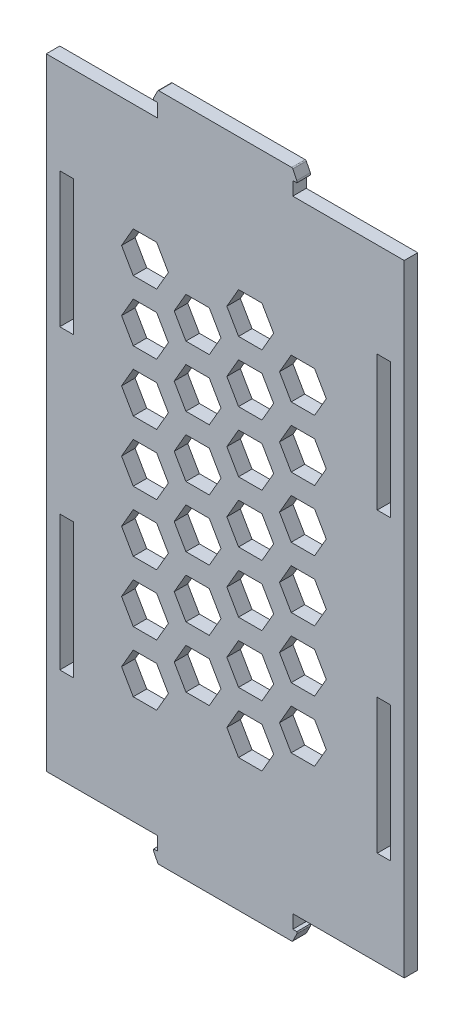
from build123d import *

# Parameters (mm, degrees)
SKETCH1_W           = 2
SKETCH1_H           = 20
BOSS_EXTRUDE1_DEPTH = 2
CUT_EXTRUDE1_DEPTH  = 110.326849401


with BuildPart() as part:
    # Sketch1 → Boss-Extrude1 (new body)
    with BuildSketch(Plane.XY):
        with BuildLine():
            Line((16.5, 0), (0, 0))
            Line((0, 0), (0, 92))
            Line((0, 92), (16.5, 92))
            Line((16.5, 92), (16.5, 94))
            Line((16.5, 94), (15.9, 94))
            ThreePointArc((15.9, 94), (15.864589803, 94.15), (15.9, 94.3))
            Line((15.9, 94.3), (16.5, 95.5))
            ThreePointArc((16.5, 95.5), (16.566697747, 95.572982477), (16.661803399, 95.6))
            Line((16.661803399, 95.6), (36.338196601, 95.6))
            ThreePointArc((36.338196601, 95.6), (36.433302253, 95.572982477), (36.5, 95.5))
            Line((36.5, 95.5), (37.1, 94.3))
            ThreePointArc((37.1, 94.3), (37.135410197, 94.15), (37.1, 94))
            Line((37.1, 94), (36.5, 94))
            Line((36.5, 94), (36.5, 92))
            Line((36.5, 92), (53, 92))
            Line((53, 92), (53, 0))
            Line((53, 0), (36.5, 0))
            Line((36.5, 0), (36.5, -2))
            Line((36.5, -2), (37.1, -2))
            ThreePointArc((37.1, -2), (37.135410197, -2.15), (37.1, -2.3))
            Line((37.1, -2.3), (36.5, -3.5))
            ThreePointArc((36.5, -3.5), (36.433302253, -3.572982477), (36.338196601, -3.6))
            Line((36.338196601, -3.6), (16.661803399, -3.6))
            ThreePointArc((16.661803399, -3.6), (16.566697747, -3.572982477), (16.5, -3.5))
            Line((16.5, -3.5), (15.9, -2.3))
            ThreePointArc((15.9, -2.3), (15.864589803, -2.15), (15.9, -2))
            Line((15.9, -2), (16.5, -2))
            Line((16.5, -2), (16.5, 0))
        make_face()
        with Locations((3, 68)):
            Rectangle(SKETCH1_W, SKETCH1_H, mode=Mode.SUBTRACT)
        with Locations((50, 68)):
            Rectangle(SKETCH1_W, SKETCH1_H, mode=Mode.SUBTRACT)
        with Locations((50, 24)):
            Rectangle(SKETCH1_W, SKETCH1_H, mode=Mode.SUBTRACT)
        with Locations((3, 24)):
            Rectangle(SKETCH1_W, SKETCH1_H, mode=Mode.SUBTRACT)
    extrude(amount=BOSS_EXTRUDE1_DEPTH)

    # Sketch2 → Cut-Extrude1 (cut, through all)
    with BuildSketch(Plane.XY.offset(2)):
        Polygon((16.344420914, 16), (18.076471722, 19), (16.344420914, 22), (12.880319299, 22), (11.148268492, 19), (12.880319299, 16), align=None)
        Polygon((20.674547933, 26.5), (18.942497126, 23.5), (20.674547933, 20.5), (24.138649548, 20.5), (25.870700356, 23.5), (24.138649548, 26.5), align=None)
        Polygon((12.880319299, 25), (16.344420914, 25), (18.076471722, 28), (16.344420914, 31), (12.880319299, 31), (11.148268492, 28), align=None)
        Polygon((20.674547933, 35.5), (18.942497126, 32.5), (20.674547933, 29.5), (24.138649548, 29.5), (25.870700356, 32.5), (24.138649548, 35.5), align=None)
        Polygon((12.880319299, 40), (11.148268492, 37), (12.880319299, 34), (16.344420914, 34), (18.076471722, 37), (16.344420914, 40), align=None)
        Polygon((20.674547933, 44.5), (18.942497126, 41.5), (20.674547933, 38.5), (24.138649548, 38.5), (25.870700356, 41.5), (24.138649548, 44.5), align=None)
        Polygon((12.880319299, 49), (11.148268492, 46), (12.880319299, 43), (16.344420914, 43), (18.076471722, 46), (16.344420914, 49), align=None)
        Polygon((12.880319299, 52), (16.344420914, 52), (18.076471722, 55), (16.344420914, 58), (12.880319299, 58), (11.148268492, 55), align=None)
        Polygon((20.674547933, 62.5), (18.942497126, 59.5), (20.674547933, 56.5), (24.138649548, 56.5), (25.870700356, 59.5), (24.138649548, 62.5), align=None)
        Polygon((12.880319299, 67), (11.148268492, 64), (12.880319299, 61), (16.344420914, 61), (18.076471722, 64), (16.344420914, 67), align=None)
        Polygon((20.674547933, 71.5), (18.942497126, 68.5), (20.674547933, 65.5), (24.138649548, 65.5), (25.870700356, 68.5), (24.138649548, 71.5), align=None)
        Polygon((12.880319299, 76), (11.148268492, 73), (12.880319299, 70), (16.344420914, 70), (18.076471722, 73), (16.344420914, 76), align=None)
        Polygon((24.138649548, 47.5), (25.870700356, 50.5), (24.138649548, 53.5), (20.674547933, 53.5), (18.942497126, 50.5), (20.674547933, 47.5), align=None)
        Polygon((31.932878182, 16), (33.66492899, 19), (31.932878182, 22), (28.468776567, 22), (26.73672576, 19), (28.468776567, 16), align=None)
        Polygon((36.263005201, 26.5), (34.530954394, 23.5), (36.263005201, 20.5), (39.727106816, 20.5), (41.459157624, 23.5), (39.727106816, 26.5), align=None)
        Polygon((28.468776567, 25), (31.932878182, 25), (33.66492899, 28), (31.932878182, 31), (28.468776567, 31), (26.73672576, 28), align=None)
        Polygon((36.263005201, 35.5), (34.530954394, 32.5), (36.263005201, 29.5), (39.727106816, 29.5), (41.459157624, 32.5), (39.727106816, 35.5), align=None)
        Polygon((28.468776567, 40), (26.73672576, 37), (28.468776567, 34), (31.932878182, 34), (33.66492899, 37), (31.932878182, 40), align=None)
        Polygon((36.263005201, 44.5), (34.530954394, 41.5), (36.263005201, 38.5), (39.727106816, 38.5), (41.459157624, 41.5), (39.727106816, 44.5), align=None)
        Polygon((28.468776567, 49), (26.73672576, 46), (28.468776567, 43), (31.932878182, 43), (33.66492899, 46), (31.932878182, 49), align=None)
        Polygon((28.468776567, 52), (31.932878182, 52), (33.66492899, 55), (31.932878182, 58), (28.468776567, 58), (26.73672576, 55), align=None)
        Polygon((36.263005201, 62.5), (34.530954394, 59.5), (36.263005201, 56.5), (39.727106816, 56.5), (41.459157624, 59.5), (39.727106816, 62.5), align=None)
        Polygon((28.468776567, 67), (26.73672576, 64), (28.468776567, 61), (31.932878182, 61), (33.66492899, 64), (31.932878182, 67), align=None)
        Polygon((36.263005201, 71.5), (34.530954394, 68.5), (36.263005201, 65.5), (39.727106816, 65.5), (41.459157624, 68.5), (39.727106816, 71.5), align=None)
        Polygon((28.468776567, 76), (26.73672576, 73), (28.468776567, 70), (31.932878182, 70), (33.66492899, 73), (31.932878182, 76), align=None)
        Polygon((39.727106816, 47.5), (41.459157624, 50.5), (39.727106816, 53.5), (36.263005201, 53.5), (34.530954394, 50.5), (36.263005201, 47.5), align=None)
    extrude(amount=-CUT_EXTRUDE1_DEPTH, mode=Mode.SUBTRACT)


solid = part.part
